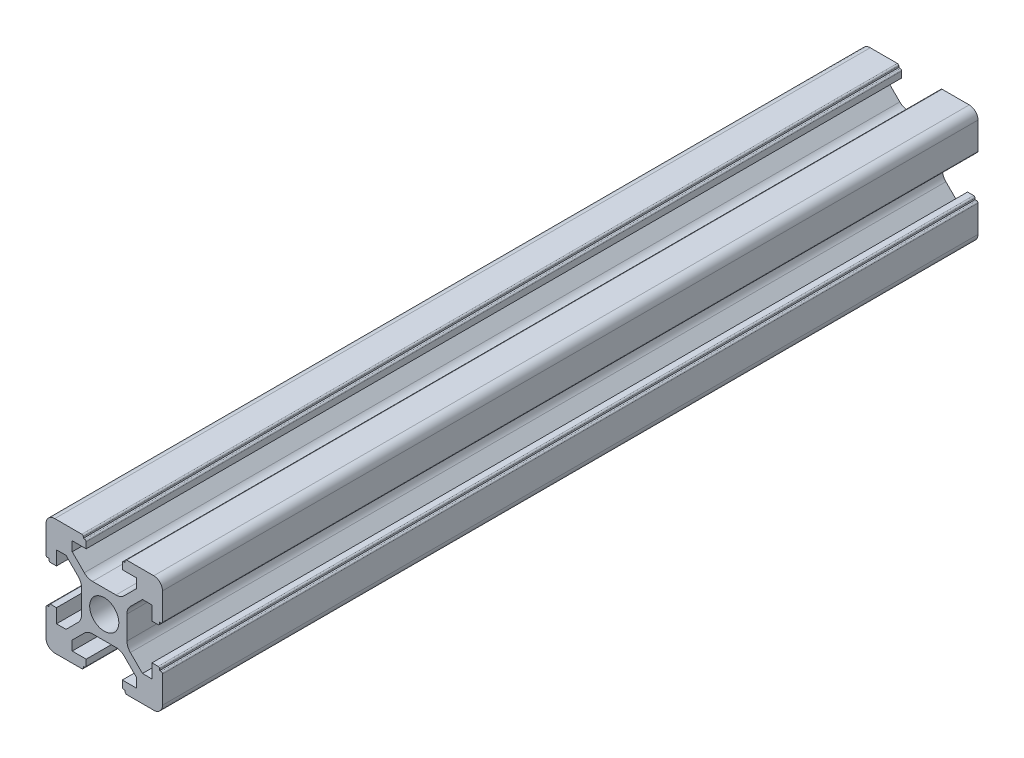
from build123d import *

# Parameters (mm, degrees)
SKETCH1_R           = 2.5
BOSS_EXTRUDE1_DEPTH = 140


with BuildPart() as part:
    # Sketch1 → Boss-Extrude1 (new body)
    with BuildSketch(Plane.XY):
        with BuildLine():
            Line((-8.5, 10), (-3.85, 10))
            ThreePointArc((-3.85, 10), (-3.673223305, 9.926776695), (-3.6, 9.75))
            Line((-3.6, 9.75), (-3.6, 9.5))
            Line((-3.6, 9.5), (-3.35, 9.5))
            ThreePointArc((-3.35, 9.5), (-3.173223305, 9.426776695), (-3.1, 9.25))
            Line((-3.1, 9.25), (-3.1, 8.2))
            Line((-3.1, 8.2), (-5.5, 8.2))
            Line((-5.5, 8.2), (-5.5, 6.560660172))
            Line((-5.5, 6.560660172), (-3.425126266, 4.485786438))
            ThreePointArc((-3.425126266, 4.485786438), (-2.776279568, 4.052240935), (-2.010912703, 3.9))
            Line((-2.010912703, 3.9), (2.010912703, 3.9))
            ThreePointArc((2.010912703, 3.9), (2.776279568, 4.052240935), (3.425126266, 4.485786438))
            Line((3.425126266, 4.485786438), (5.5, 6.560660172))
            Line((5.5, 6.560660172), (5.5, 8.2))
            Line((5.5, 8.2), (3.1, 8.2))
            Line((3.1, 8.2), (3.1, 9.25))
            ThreePointArc((3.1, 9.25), (3.173223305, 9.426776695), (3.35, 9.5))
            Line((3.35, 9.5), (3.6, 9.5))
            Line((3.6, 9.5), (3.6, 9.75))
            ThreePointArc((3.6, 9.75), (3.673223305, 9.926776695), (3.85, 10))
            Line((3.85, 10), (8.5, 10))
            ThreePointArc((8.5, 10), (9.560660172, 9.560660172), (10, 8.5))
            Line((10, 8.5), (10, 3.85))
            ThreePointArc((10, 3.85), (9.926776695, 3.673223305), (9.75, 3.6))
            Line((9.75, 3.6), (9.5, 3.6))
            Line((9.5, 3.6), (9.5, 3.35))
            ThreePointArc((9.5, 3.35), (9.426776695, 3.173223305), (9.25, 3.1))
            Line((9.25, 3.1), (8.2, 3.1))
            Line((8.2, 3.1), (8.2, 5.5))
            Line((8.2, 5.5), (6.560660172, 5.5))
            Line((6.560660172, 5.5), (4.485786438, 3.425126266))
            ThreePointArc((4.485786438, 3.425126266), (4.052240935, 2.776279568), (3.9, 2.010912703))
            Line((3.9, 2.010912703), (3.9, -2.010912703))
            ThreePointArc((3.9, -2.010912703), (4.052240935, -2.776279568), (4.485786438, -3.425126266))
            Line((4.485786438, -3.425126266), (6.560660172, -5.5))
            Line((6.560660172, -5.5), (8.2, -5.5))
            Line((8.2, -5.5), (8.2, -3.1))
            Line((8.2, -3.1), (9.25, -3.1))
            ThreePointArc((9.25, -3.1), (9.426776695, -3.173223305), (9.5, -3.35))
            Line((9.5, -3.35), (9.5, -3.6))
            Line((9.5, -3.6), (9.75, -3.6))
            ThreePointArc((9.75, -3.6), (9.926776695, -3.673223305), (10, -3.85))
            Line((10, -3.85), (10, -8.5))
            ThreePointArc((10, -8.5), (9.560660172, -9.560660172), (8.5, -10))
            Line((8.5, -10), (3.85, -10))
            ThreePointArc((3.85, -10), (3.673223305, -9.926776695), (3.6, -9.75))
            Line((3.6, -9.75), (3.6, -9.5))
            Line((3.6, -9.5), (3.35, -9.5))
            ThreePointArc((3.35, -9.5), (3.173223305, -9.426776695), (3.1, -9.25))
            Line((3.1, -9.25), (3.1, -8.2))
            Line((3.1, -8.2), (5.5, -8.2))
            Line((5.5, -8.2), (5.5, -6.560660172))
            Line((5.5, -6.560660172), (3.425126266, -4.485786438))
            ThreePointArc((3.425126266, -4.485786438), (2.776279568, -4.052240935), (2.010912703, -3.9))
            Line((2.010912703, -3.9), (-2.010912703, -3.9))
            ThreePointArc((-2.010912703, -3.9), (-2.776279568, -4.052240935), (-3.425126266, -4.485786438))
            Line((-3.425126266, -4.485786438), (-5.5, -6.560660172))
            Line((-5.5, -6.560660172), (-5.5, -8.2))
            Line((-5.5, -8.2), (-3.1, -8.2))
            Line((-3.1, -8.2), (-3.1, -9.25))
            ThreePointArc((-3.1, -9.25), (-3.173223305, -9.426776695), (-3.35, -9.5))
            Line((-3.35, -9.5), (-3.6, -9.5))
            Line((-3.6, -9.5), (-3.6, -9.75))
            ThreePointArc((-3.6, -9.75), (-3.673223305, -9.926776695), (-3.85, -10))
            Line((-3.85, -10), (-8.5, -10))
            ThreePointArc((-8.5, -10), (-9.560660172, -9.560660172), (-10, -8.5))
            Line((-10, -8.5), (-10, -3.85))
            ThreePointArc((-10, -3.85), (-9.926776695, -3.673223305), (-9.75, -3.6))
            Line((-9.75, -3.6), (-9.5, -3.6))
            Line((-9.5, -3.6), (-9.5, -3.35))
            ThreePointArc((-9.5, -3.35), (-9.426776695, -3.173223305), (-9.25, -3.1))
            Line((-9.25, -3.1), (-8.2, -3.1))
            Line((-8.2, -3.1), (-8.2, -5.5))
            Line((-8.2, -5.5), (-6.560660172, -5.5))
            Line((-6.560660172, -5.5), (-4.485786438, -3.425126266))
            ThreePointArc((-4.485786438, -3.425126266), (-4.052240935, -2.776279568), (-3.9, -2.010912703))
            Line((-3.9, -2.010912703), (-3.9, 2.010912703))
            ThreePointArc((-3.9, 2.010912703), (-4.052240935, 2.776279568), (-4.485786438, 3.425126266))
            Line((-4.485786438, 3.425126266), (-6.560660172, 5.5))
            Line((-6.560660172, 5.5), (-8.2, 5.5))
            Line((-8.2, 5.5), (-8.2, 3.1))
            Line((-8.2, 3.1), (-9.25, 3.1))
            ThreePointArc((-9.25, 3.1), (-9.426776695, 3.173223305), (-9.5, 3.35))
            Line((-9.5, 3.35), (-9.5, 3.6))
            Line((-9.5, 3.6), (-9.75, 3.6))
            ThreePointArc((-9.75, 3.6), (-9.926776695, 3.673223305), (-10, 3.85))
            Line((-10, 3.85), (-10, 8.5))
            ThreePointArc((-10, 8.5), (-9.560660172, 9.560660172), (-8.5, 10))
        make_face()
        Circle(SKETCH1_R, mode=Mode.SUBTRACT)
    extrude(amount=BOSS_EXTRUDE1_DEPTH)


solid = part.part
